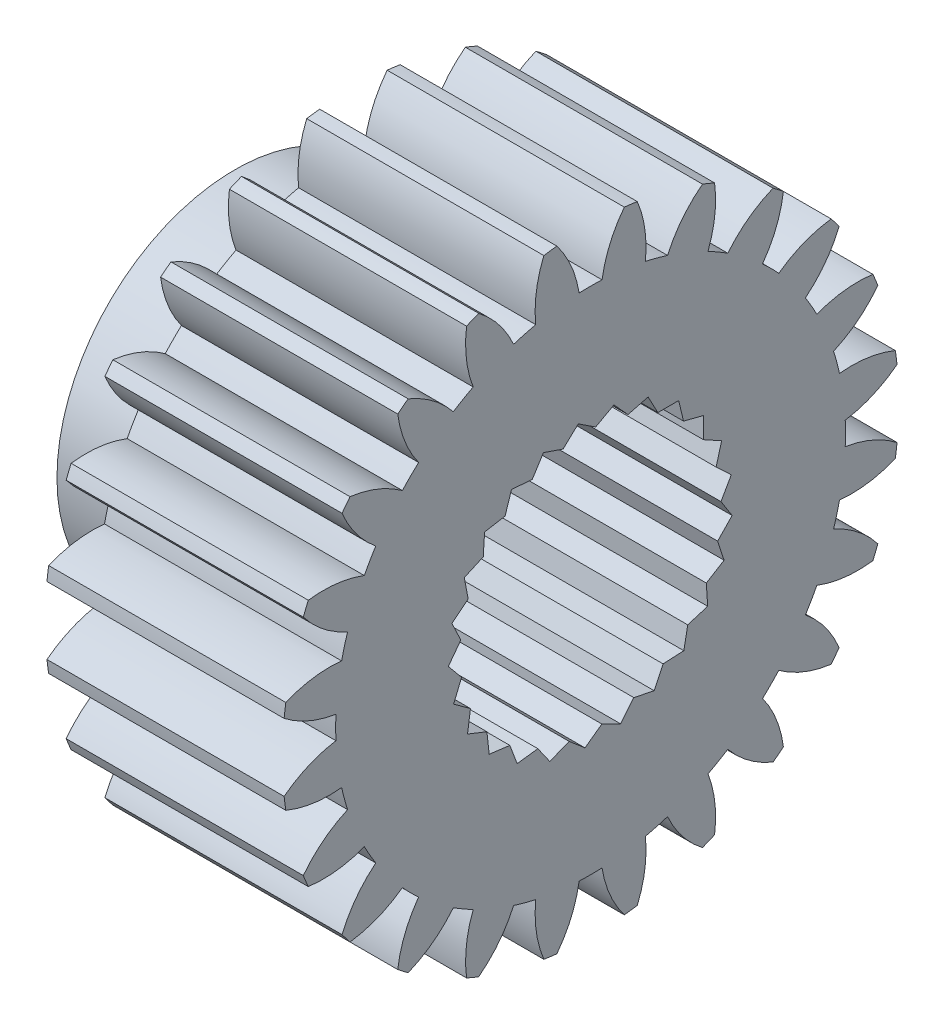
from build123d import *
from build123d.topology import SkipClean

# Parameters (mm, degrees)
BASPROSKE_W             = 5
BASPROSKE_H             = 6.5
TOOTHCUT_DEPTH          = 11.464224768
TEETHCUTS_COUNT         = 24
TEETHCUTS_ANGLE         = 345
BORSKE_R                = 1.5
BORE_DEPTH              = 50.0000508
CUT_EXTRUDE1_DEPTH      = 11.41575718
CUT_EXTRUDE1_DEPTH_BACK = 11.41575718
SKETCH1_R               = 2.75
SKETCH2_R               = 3.75
SKETCH2_R_2             = 2.75
BOSS_EXTRUDE1_DEPTH     = 2.5
CUT_EXTRUDE2_DEPTH      = 12.821082761
CIRPATTERN1_COUNT       = 25


with BuildPart() as part:
    # BasProSke → Base-Revolve (revolve)
    with BuildSketch(Plane(origin=(0, 0, 0), x_dir=(1, 0, 0), z_dir=(0, 1, 0)), mode=Mode.PRIVATE) as base_revolve_sk:
        with Locations((2.5, 3.25)):
            Rectangle(BASPROSKE_W, BASPROSKE_H)
    revolve(base_revolve_sk.sketch.rotate(Axis((-10, 0, 0), (1, 0, 0)), 180), axis=Axis((-10, 0, 0), (1, 0, 0)))

    # TooCutSke → ToothCut (cut, through all)
    with BuildSketch(Plane(origin=(0, 0, 0), x_dir=(0, 0, -1), z_dir=(1, 0, 0))):
        with BuildLine():
            ThreePointArc((0.241646108, 5.368564348), (0, 5.374), (-0.241646108, 5.368564348))
            ThreePointArc((-0.241646108, 5.368564348), (-0.413699957, 5.957993365), (-0.729686037, 6.48447403))
            ThreePointArc((-0.729686037, 6.48447403), (0, 6.5254), (0.729686037, 6.48447403))
            ThreePointArc((0.729686037, 6.48447403), (0.413699957, 5.957993365), (0.241646108, 5.368564348))
        make_face()
    toothcut = extrude(amount=TOOTHCUT_DEPTH, mode=Mode.SUBTRACT)

    # TeethCuts: ToothCut ×24 about axis
    teethcuts_axis = Axis((-10, 0, 0), (1, 0, 0))
    for i in range(1, TEETHCUTS_COUNT):
        add(toothcut.rotate(teethcuts_axis, i * TEETHCUTS_ANGLE / (TEETHCUTS_COUNT - 1)), mode=Mode.SUBTRACT)

    # BorSke → Bore (cut, symmetric)
    with BuildSketch(Plane(origin=(0, 0, 0), x_dir=(0, 0, -1), z_dir=(1, 0, 0))):
        with Locations(Location((0, 0, 0), (0, 0, 180))):
            Circle(BORSKE_R)
    extrude(amount=BORE_DEPTH, both=True, mode=Mode.SUBTRACT)

    # Sketch1 → Cut-Extrude1 (cut, two sides: drawn at the far end of the back side and taken through both)
    with BuildSketch(Plane(origin=(5, 0, 0), x_dir=(0, 0, -1), z_dir=(1, 0, 0)).offset(-CUT_EXTRUDE1_DEPTH_BACK)):
        Circle(SKETCH1_R)
    extrude(amount=CUT_EXTRUDE1_DEPTH + CUT_EXTRUDE1_DEPTH_BACK, mode=Mode.SUBTRACT)

    # Sketch2 → Boss-Extrude1 (add)
    with SkipClean():  # the faces are left unmerged after this step: merging them gives an invalid solid
        with BuildSketch(Plane.ZY):
            with Locations(Location((0, 0, 0), (0, 0, 180))):
                Circle(SKETCH2_R)
            Circle(SKETCH2_R_2, mode=Mode.SUBTRACT)
        extrude(amount=BOSS_EXTRUDE1_DEPTH)

    # Sketch1<3> → Cut-Extrude2 (cut, symmetric)
    with BuildSketch(Plane(origin=(5, 0, 0), x_dir=(0, 0, -1), z_dir=(1, 0, 0))):
        with BuildLine():
            ThreePointArc((0.237491085, -2.739725896), (-0.107760308, -2.747887865), (-0.451312258, -2.712714))
            Line((-0.451312258, -2.712714), (-0.1175567, -2.997695852))
            Line((-0.1175567, -2.997695852), (0.237491085, -2.739725896))
        make_face()
    cut_extrude2 = extrude(amount=CUT_EXTRUDE2_DEPTH, both=True, mode=Mode.SUBTRACT)

    # CirPattern1: Cut-Extrude2 ×25 about axis
    cirpattern1_axis = Axis((0, 0, 0), (1, 0, 0))
    for i in range(1, CIRPATTERN1_COUNT):
        add(cut_extrude2.rotate(cirpattern1_axis, i * 360 / CIRPATTERN1_COUNT), mode=Mode.SUBTRACT)


solid = part.part
